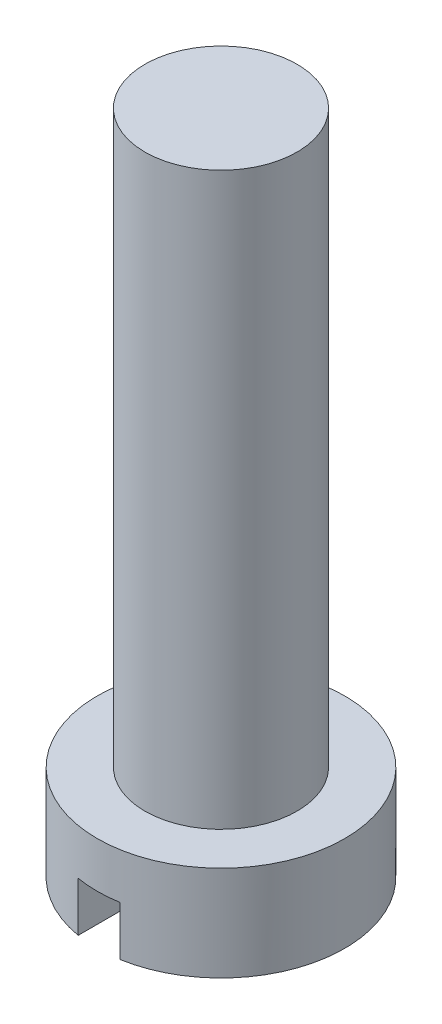
from build123d import *

# Parameters (mm, degrees)
SKETCH_1_R          = 6.5
EXTRUDE_1_DEPTH     = 5
SKETCH_2_W          = 2.2
SKETCH_2_H          = 2.6
CUT_EXTRUDE_1_DEPTH = 6.95
SKETCH_3_R          = 4
EXTRUDE_2_DEPTH     = 30


with BuildPart() as part:
    # Эскиз1 → Бобышка-Вытянуть1 (new body)
    with BuildSketch(Plane(origin=(0, 0, 0), x_dir=(1, 0, 0), z_dir=(0, 1, 0))):
        with Locations(Location((0, 0, 0), (0, 0, 270))):
            Circle(SKETCH_1_R)
    extrude(amount=EXTRUDE_1_DEPTH)

    # Эскиз2 → Вырез-Вытянуть1 (cut, symmetric)
    with BuildSketch(Plane.XY):
        with Locations((0, 1.3)):
            Rectangle(SKETCH_2_W, SKETCH_2_H)
    extrude(amount=CUT_EXTRUDE_1_DEPTH, both=True, mode=Mode.SUBTRACT)

    # Эскиз3 → Бобышка-Вытянуть2 (add)
    with BuildSketch(Plane(origin=(0, 5, 0), x_dir=(1, 0, 0), z_dir=(0, 1, 0))):
        with Locations(Location((0, 0, 0), (0, 0, 270))):
            Circle(SKETCH_3_R)
    extrude(amount=EXTRUDE_2_DEPTH)


solid = part.part
